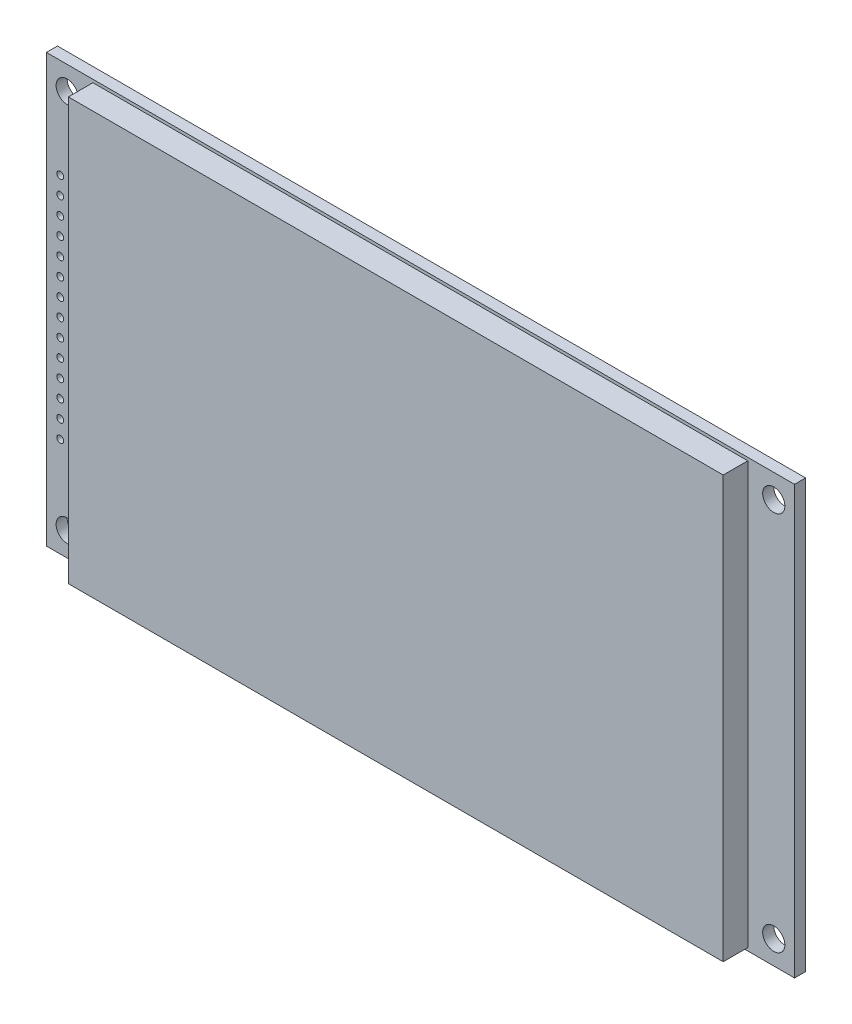
from build123d import *

# Parameters (mm, degrees)
SKETCH1_W           = 108.04
SKETCH1_H           = 61.74
SKETCH1_R           = 1.6
BOSS_EXTRUDE1_DEPTH = 1.6
SKETCH2_W           = 94.57
SKETCH2_H           = 60.88
BOSS_EXTRUDE2_DEPTH = 3.55
SKETCH3_R           = 0.5
CUT_EXTRUDE1_DEPTH  = 3.55


with BuildPart() as part:
    # Sketch1 → Boss-Extrude1 (new body)
    with BuildSketch(Plane.XY):
        Rectangle(SKETCH1_W, SKETCH1_H)
        with Locations((-51.02, 27.45)):
            Circle(SKETCH1_R, mode=Mode.SUBTRACT)
        with Locations((-51.02, -27.45)):
            Circle(SKETCH1_R, mode=Mode.SUBTRACT)
        with Locations((51.02, -27.45)):
            Circle(SKETCH1_R, mode=Mode.SUBTRACT)
        with Locations((51.02, 27.45)):
            Circle(SKETCH1_R, mode=Mode.SUBTRACT)
    extrude(amount=BOSS_EXTRUDE1_DEPTH)

    # Sketch2 → Boss-Extrude2 (add)
    with BuildSketch(Plane.XY.offset(1.6)):
        with Locations((-0.015, 0)):
            Rectangle(SKETCH2_W, SKETCH2_H)
    extrude(amount=BOSS_EXTRUDE2_DEPTH)

    # Sketch3 → Cut-Extrude1 (cut)
    with BuildSketch(Plane.XY.offset(1.6)):
        with Locations((-52.02, 16.51)):
            Circle(SKETCH3_R)
        with Locations((-52.02, 13.97)):
            Circle(SKETCH3_R)
        with Locations((-52.02, 11.43)):
            Circle(SKETCH3_R)
        with Locations((-52.02, 8.89)):
            Circle(SKETCH3_R)
        with Locations((-52.02, 6.35)):
            Circle(SKETCH3_R)
        with Locations((-52.02, 3.81)):
            Circle(SKETCH3_R)
        with Locations((-52.02, 1.27)):
            Circle(SKETCH3_R)
        with Locations((-52.02, -1.27)):
            Circle(SKETCH3_R)
        with Locations((-52.02, -3.81)):
            Circle(SKETCH3_R)
        with Locations((-52.02, -6.35)):
            Circle(SKETCH3_R)
        with Locations((-52.02, -8.89)):
            Circle(SKETCH3_R)
        with Locations((-52.02, -11.43)):
            Circle(SKETCH3_R)
        with Locations((-52.02, -13.97)):
            Circle(SKETCH3_R)
        with Locations((-52.02, -16.51)):
            Circle(SKETCH3_R)
    extrude(amount=-CUT_EXTRUDE1_DEPTH, mode=Mode.SUBTRACT)


solid = part.part
